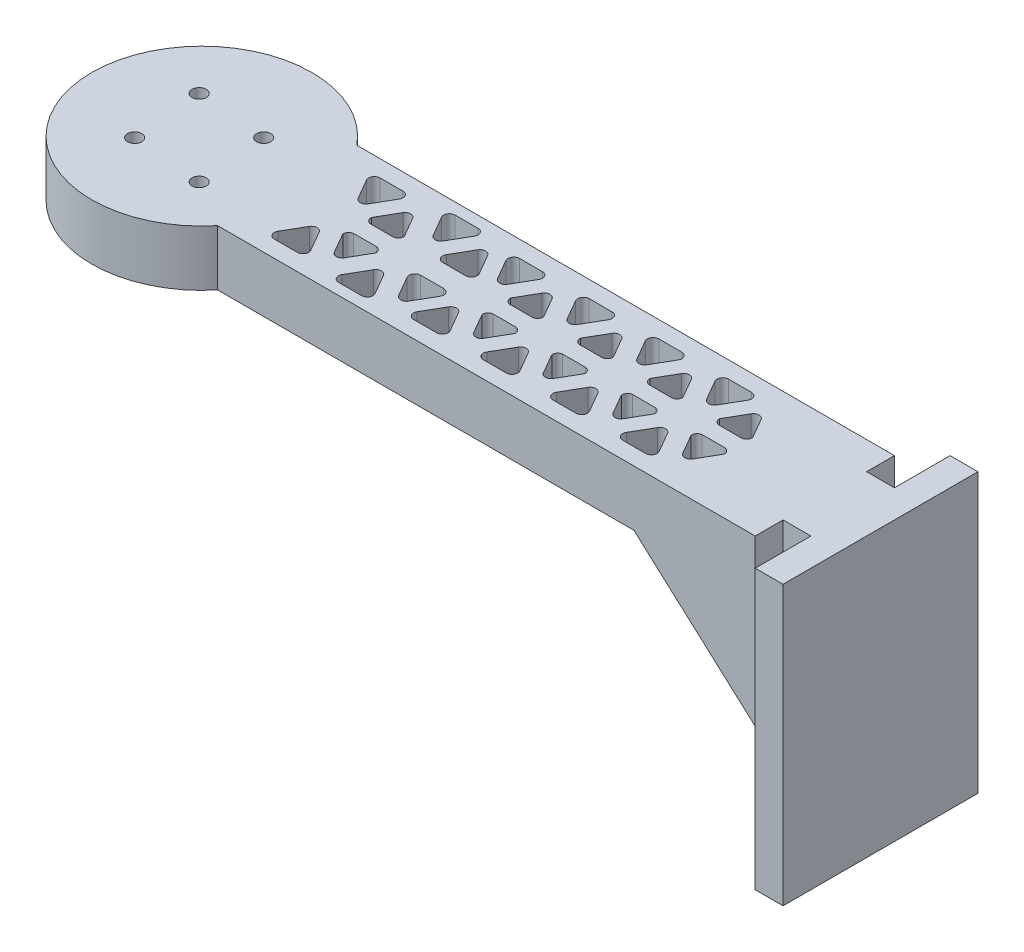
from build123d import *

# Parameters (mm, degrees)
SKETCH1_R           = 1.279919877
BOSS_EXTRUDE2_DEPTH = 10
BOSS_EXTRUDE3_DEPTH = 50
BOSS_EXTRUDE4_REACH = 134.247
CUT_EXTRUDE1_REACH  = 135.257
SKETCH2_3_W         = 5
SKETCH2_3_H         = 5


with BuildPart() as part:
    # Sketch1 → Boss-Extrude2 (new body)
    with BuildSketch(Plane(origin=(0, 0, 0), x_dir=(1, 0, 0), z_dir=(0, 1, 0))):
        with BuildLine():
            Line((121.848372292, 12.975710063), (15.332022575, 12.975710063))
            ThreePointArc((15.332022575, 12.975710063), (-19.781832985, 0.475710063), (15.332022575, -12.024289937))
            Line((15.332022575, -12.024289937), (121.848372292, -12.024289937))
            Line((121.848372292, -12.024289937), (121.848372292, 12.975710063))
        make_face()
        with BuildLine():
            Line((27.867718097, 3.040074135), (29.934981691, 6.618383951))
            ThreePointArc((29.934981691, 6.618383951), (30.821593952, 7.13010561), (31.708206213, 6.618383951))
            Line((31.708206213, 6.618383951), (33.775469807, 3.032226152))
            ThreePointArc((33.775469807, 3.032226152), (33.536731527, 2.332297873), (32.888857546, 1.975710063))
            Line((32.888857546, 1.975710063), (28.754330358, 1.975710063))
            ThreePointArc((28.754330358, 1.975710063), (28.103716588, 2.335205422), (27.867718097, 3.040074135))
        make_face(mode=Mode.SUBTRACT)
        with BuildLine():
            ThreePointArc((46.281498727, 3.999342244), (46.287424275, 2.96938023), (45.394886466, 2.455344118))
            Line((45.394886466, 2.455344118), (41.260359278, 2.455344118))
            ThreePointArc((41.260359278, 2.455344118), (40.373533681, 2.967435229), (40.373747018, 3.991494261))
            Line((40.373747018, 3.991494261), (42.441010611, 7.57765206))
            ThreePointArc((42.441010611, 7.57765206), (43.327622872, 8.08937372), (44.214235133, 7.57765206))
            Line((44.214235133, 7.57765206), (46.281498727, 3.999342244))
        make_face(mode=Mode.SUBTRACT)
        with BuildLine():
            ThreePointArc((21.614703637, 8.43955992), (21.6144903, 9.463618952), (22.501315898, 9.975710063))
            Line((22.501315898, 9.975710063), (26.635843086, 9.975710063))
            ThreePointArc((26.635843086, 9.975710063), (27.522668684, 9.463618952), (27.522455347, 8.43955992))
            Line((27.522455347, 8.43955992), (25.455191753, 4.861250104))
            ThreePointArc((25.455191753, 4.861250104), (24.568579492, 4.349528444), (23.681967231, 4.861250104))
            Line((23.681967231, 4.861250104), (21.614703637, 8.43955992))
        make_face(mode=Mode.SUBTRACT)
        with BuildLine():
            ThreePointArc((39.141872006, 10.934978173), (40.028697604, 10.422887062), (40.028484267, 9.398828029))
            Line((40.028484267, 9.398828029), (37.961220673, 5.820518214))
            ThreePointArc((37.961220673, 5.820518214), (37.074608412, 5.308796554), (36.187996151, 5.820518214))
            Line((36.187996151, 5.820518214), (34.120732557, 9.398828029))
            ThreePointArc((34.120732557, 9.398828029), (34.12051922, 10.422887062), (35.007344818, 10.934978173))
            Line((35.007344818, 10.934978173), (39.141872006, 10.934978173))
        make_face(mode=Mode.SUBTRACT)
        with BuildLine():
            ThreePointArc((46.634703637, 8.43955992), (46.6344903, 9.463618952), (47.521315898, 9.975710063))
            Line((47.521315898, 9.975710063), (51.655843086, 9.975710063))
            ThreePointArc((51.655843086, 9.975710063), (52.542668684, 9.463618952), (52.542455347, 8.43955992))
            Line((52.542455347, 8.43955992), (50.475191753, 4.861250104))
            ThreePointArc((50.475191753, 4.861250104), (49.588579492, 4.349528444), (48.701967231, 4.861250104))
            Line((48.701967231, 4.861250104), (46.634703637, 8.43955992))
        make_face(mode=Mode.SUBTRACT)
        with BuildLine():
            Line((52.887718097, 3.040074135), (54.954981691, 6.618383951))
            ThreePointArc((54.954981691, 6.618383951), (55.841593952, 7.13010561), (56.728206213, 6.618383951))
            Line((56.728206213, 6.618383951), (58.795469807, 3.032226152))
            ThreePointArc((58.795469807, 3.032226152), (58.556731527, 2.332297873), (57.908857546, 1.975710063))
            Line((57.908857546, 1.975710063), (53.774330358, 1.975710063))
            ThreePointArc((53.774330358, 1.975710063), (53.123716588, 2.335205422), (52.887718097, 3.040074135))
        make_face(mode=Mode.SUBTRACT)
        with BuildLine():
            Line((65.397718097, 3.040074135), (67.464981691, 6.618383951))
            ThreePointArc((67.464981691, 6.618383951), (68.351593952, 7.13010561), (69.238206213, 6.618383951))
            Line((69.238206213, 6.618383951), (71.305469807, 3.032226152))
            ThreePointArc((71.305469807, 3.032226152), (71.066731527, 2.332297873), (70.418857546, 1.975710063))
            Line((70.418857546, 1.975710063), (66.284330358, 1.975710063))
            ThreePointArc((66.284330358, 1.975710063), (65.633716588, 2.335205422), (65.397718097, 3.040074135))
        make_face(mode=Mode.SUBTRACT)
        with BuildLine():
            Line((77.907718097, 3.040074135), (79.974981691, 6.618383951))
            ThreePointArc((79.974981691, 6.618383951), (80.861593952, 7.13010561), (81.748206213, 6.618383951))
            Line((81.748206213, 6.618383951), (83.815469807, 3.032226152))
            ThreePointArc((83.815469807, 3.032226152), (83.576731527, 2.332297873), (82.928857546, 1.975710063))
            Line((82.928857546, 1.975710063), (78.794330358, 1.975710063))
            ThreePointArc((78.794330358, 1.975710063), (78.143716588, 2.335205422), (77.907718097, 3.040074135))
        make_face(mode=Mode.SUBTRACT)
        with BuildLine():
            ThreePointArc((59.144703637, 8.43955992), (59.1444903, 9.463618952), (60.031315898, 9.975710063))
            Line((60.031315898, 9.975710063), (64.165843086, 9.975710063))
            ThreePointArc((64.165843086, 9.975710063), (65.052668684, 9.463618952), (65.052455347, 8.43955992))
            Line((65.052455347, 8.43955992), (62.985191753, 4.861250104))
            ThreePointArc((62.985191753, 4.861250104), (62.098579492, 4.349528444), (61.211967231, 4.861250104))
            Line((61.211967231, 4.861250104), (59.144703637, 8.43955992))
        make_face(mode=Mode.SUBTRACT)
        with BuildLine():
            ThreePointArc((71.654703637, 8.43955992), (71.6544903, 9.463618952), (72.541315898, 9.975710063))
            Line((72.541315898, 9.975710063), (76.675843086, 9.975710063))
            ThreePointArc((76.675843086, 9.975710063), (77.562668684, 9.463618952), (77.562455347, 8.43955992))
            Line((77.562455347, 8.43955992), (75.495191753, 4.861250104))
            ThreePointArc((75.495191753, 4.861250104), (74.608579492, 4.349528444), (73.721967231, 4.861250104))
            Line((73.721967231, 4.861250104), (71.654703637, 8.43955992))
        make_face(mode=Mode.SUBTRACT)
        with BuildLine():
            Line((90.417718097, 3.040074135), (92.484981691, 6.618383951))
            ThreePointArc((92.484981691, 6.618383951), (93.371593952, 7.13010561), (94.258206213, 6.618383951))
            Line((94.258206213, 6.618383951), (96.325469807, 3.032226152))
            ThreePointArc((96.325469807, 3.032226152), (96.086731527, 2.332297873), (95.438857546, 1.975710063))
            Line((95.438857546, 1.975710063), (91.304330358, 1.975710063))
            ThreePointArc((91.304330358, 1.975710063), (90.653716588, 2.335205422), (90.417718097, 3.040074135))
        make_face(mode=Mode.SUBTRACT)
        with BuildLine():
            ThreePointArc((84.164703637, 8.43955992), (84.1644903, 9.463618952), (85.051315898, 9.975710063))
            Line((85.051315898, 9.975710063), (89.185843086, 9.975710063))
            ThreePointArc((89.185843086, 9.975710063), (90.072668684, 9.463618952), (90.072455347, 8.43955992))
            Line((90.072455347, 8.43955992), (88.005191753, 4.861250104))
            ThreePointArc((88.005191753, 4.861250104), (87.118579492, 4.349528444), (86.231967231, 4.861250104))
            Line((86.231967231, 4.861250104), (84.164703637, 8.43955992))
        make_face(mode=Mode.SUBTRACT)
        with Locations(Location((5.792256156, 5.792256156, 0), (0, 0, 270))):
            Circle(SKETCH1_R, mode=Mode.SUBTRACT)
        with Locations(Location((-5.792256156, -5.792256156, 0), (0, 0, 270))):
            Circle(SKETCH1_R, mode=Mode.SUBTRACT)
        with Locations(Location((6.878304186, -6.878304186, 0), (0, 0, 270))):
            Circle(SKETCH1_R, mode=Mode.SUBTRACT)
        with Locations(Location((-6.878304186, 6.878304186, 0), (0, 0, 270))):
            Circle(SKETCH1_R, mode=Mode.SUBTRACT)
        with BuildLine():
            ThreePointArc((95.438857546, -1.024289937), (96.086731527, -1.380877747), (96.325469807, -2.080806025))
            Line((96.325469807, -2.080806025), (94.258206213, -5.666963824))
            ThreePointArc((94.258206213, -5.666963824), (93.371593952, -6.178685484), (92.484981691, -5.666963824))
            Line((92.484981691, -5.666963824), (90.417718097, -2.088654008))
            ThreePointArc((90.417718097, -2.088654008), (90.653716588, -1.383785295), (91.304330358, -1.024289937))
            Line((91.304330358, -1.024289937), (95.438857546, -1.024289937))
        make_face(mode=Mode.SUBTRACT)
        with BuildLine():
            Line((21.614703637, -7.488139793), (23.681967231, -3.909829978))
            ThreePointArc((23.681967231, -3.909829978), (24.568579492, -3.398108318), (25.455191753, -3.909829978))
            Line((25.455191753, -3.909829978), (27.522455347, -7.488139793))
            ThreePointArc((27.522455347, -7.488139793), (27.522668684, -8.512198826), (26.635843086, -9.024289937))
            Line((26.635843086, -9.024289937), (22.501315898, -9.024289937))
            ThreePointArc((22.501315898, -9.024289937), (21.6144903, -8.512198826), (21.614703637, -7.488139793))
        make_face(mode=Mode.SUBTRACT)
        with BuildLine():
            ThreePointArc((40.028484267, -8.447407903), (40.028697604, -9.471466935), (39.141872006, -9.983558046))
            Line((39.141872006, -9.983558046), (35.007344818, -9.983558046))
            ThreePointArc((35.007344818, -9.983558046), (34.12051922, -9.471466935), (34.120732557, -8.447407903))
            Line((34.120732557, -8.447407903), (36.187996151, -4.869098087))
            ThreePointArc((36.187996151, -4.869098087), (37.074608412, -4.357376427), (37.961220673, -4.869098087))
            Line((37.961220673, -4.869098087), (40.028484267, -8.447407903))
        make_face(mode=Mode.SUBTRACT)
        with BuildLine():
            Line((46.634703637, -7.488139793), (48.701967231, -3.909829978))
            ThreePointArc((48.701967231, -3.909829978), (49.588579492, -3.398108318), (50.475191753, -3.909829978))
            Line((50.475191753, -3.909829978), (52.542455347, -7.488139793))
            ThreePointArc((52.542455347, -7.488139793), (52.542668684, -8.512198826), (51.655843086, -9.024289937))
            Line((51.655843086, -9.024289937), (47.521315898, -9.024289937))
            ThreePointArc((47.521315898, -9.024289937), (46.6344903, -8.512198826), (46.634703637, -7.488139793))
        make_face(mode=Mode.SUBTRACT)
        with BuildLine():
            ThreePointArc((27.867718097, -2.088654008), (28.103716588, -1.383785295), (28.754330358, -1.024289937))
            Line((28.754330358, -1.024289937), (32.888857546, -1.024289937))
            ThreePointArc((32.888857546, -1.024289937), (33.536731527, -1.380877747), (33.775469807, -2.080806025))
            Line((33.775469807, -2.080806025), (31.708206213, -5.666963824))
            ThreePointArc((31.708206213, -5.666963824), (30.821593952, -6.178685484), (29.934981691, -5.666963824))
            Line((29.934981691, -5.666963824), (27.867718097, -2.088654008))
        make_face(mode=Mode.SUBTRACT)
        with BuildLine():
            Line((46.281498727, -3.047922118), (44.214235133, -6.626231934))
            ThreePointArc((44.214235133, -6.626231934), (43.327622872, -7.137953593), (42.441010611, -6.626231934))
            Line((42.441010611, -6.626231934), (40.373747018, -3.040074135))
            ThreePointArc((40.373747018, -3.040074135), (40.373533681, -2.016015103), (41.260359278, -1.503923991))
            Line((41.260359278, -1.503923991), (45.394886466, -1.503923991))
            ThreePointArc((45.394886466, -1.503923991), (46.287424275, -2.017960103), (46.281498727, -3.047922118))
        make_face(mode=Mode.SUBTRACT)
        with BuildLine():
            Line((59.144703637, -7.488139793), (61.211967231, -3.909829978))
            ThreePointArc((61.211967231, -3.909829978), (62.098579492, -3.398108318), (62.985191753, -3.909829978))
            Line((62.985191753, -3.909829978), (65.052455347, -7.488139793))
            ThreePointArc((65.052455347, -7.488139793), (65.052668684, -8.512198826), (64.165843086, -9.024289937))
            Line((64.165843086, -9.024289937), (60.031315898, -9.024289937))
            ThreePointArc((60.031315898, -9.024289937), (59.1444903, -8.512198826), (59.144703637, -7.488139793))
        make_face(mode=Mode.SUBTRACT)
        with BuildLine():
            Line((71.654703637, -7.488139793), (73.721967231, -3.909829978))
            ThreePointArc((73.721967231, -3.909829978), (74.608579492, -3.398108318), (75.495191753, -3.909829978))
            Line((75.495191753, -3.909829978), (77.562455347, -7.488139793))
            ThreePointArc((77.562455347, -7.488139793), (77.562668684, -8.512198826), (76.675843086, -9.024289937))
            Line((76.675843086, -9.024289937), (72.541315898, -9.024289937))
            ThreePointArc((72.541315898, -9.024289937), (71.6544903, -8.512198826), (71.654703637, -7.488139793))
        make_face(mode=Mode.SUBTRACT)
        with BuildLine():
            ThreePointArc((52.887718097, -2.088654008), (53.123716588, -1.383785295), (53.774330358, -1.024289937))
            Line((53.774330358, -1.024289937), (57.908857546, -1.024289937))
            ThreePointArc((57.908857546, -1.024289937), (58.556731527, -1.380877747), (58.795469807, -2.080806025))
            Line((58.795469807, -2.080806025), (56.728206213, -5.666963824))
            ThreePointArc((56.728206213, -5.666963824), (55.841593952, -6.178685484), (54.954981691, -5.666963824))
            Line((54.954981691, -5.666963824), (52.887718097, -2.088654008))
        make_face(mode=Mode.SUBTRACT)
        with BuildLine():
            ThreePointArc((65.397718097, -2.088654008), (65.633716588, -1.383785295), (66.284330358, -1.024289937))
            Line((66.284330358, -1.024289937), (70.418857546, -1.024289937))
            ThreePointArc((70.418857546, -1.024289937), (71.066731527, -1.380877747), (71.305469807, -2.080806025))
            Line((71.305469807, -2.080806025), (69.238206213, -5.666963824))
            ThreePointArc((69.238206213, -5.666963824), (68.351593952, -6.178685484), (67.464981691, -5.666963824))
            Line((67.464981691, -5.666963824), (65.397718097, -2.088654008))
        make_face(mode=Mode.SUBTRACT)
        with BuildLine():
            ThreePointArc((77.907718097, -2.088654008), (78.143716588, -1.383785295), (78.794330358, -1.024289937))
            Line((78.794330358, -1.024289937), (82.928857546, -1.024289937))
            ThreePointArc((82.928857546, -1.024289937), (83.576731527, -1.380877747), (83.815469807, -2.080806025))
            Line((83.815469807, -2.080806025), (81.748206213, -5.666963824))
            ThreePointArc((81.748206213, -5.666963824), (80.861593952, -6.178685484), (79.974981691, -5.666963824))
            Line((79.974981691, -5.666963824), (77.907718097, -2.088654008))
        make_face(mode=Mode.SUBTRACT)
        with BuildLine():
            Line((84.164703637, -7.488139793), (86.231967231, -3.909829978))
            ThreePointArc((86.231967231, -3.909829978), (87.118579492, -3.398108318), (88.005191753, -3.909829978))
            Line((88.005191753, -3.909829978), (90.072455347, -7.488139793))
            ThreePointArc((90.072455347, -7.488139793), (90.072668684, -8.512198826), (89.185843086, -9.024289937))
            Line((89.185843086, -9.024289937), (85.051315898, -9.024289937))
            ThreePointArc((85.051315898, -9.024289937), (84.1644903, -8.512198826), (84.164703637, -7.488139793))
        make_face(mode=Mode.SUBTRACT)
    extrude(amount=BOSS_EXTRUDE2_DEPTH)

    # Sketch2 → Boss-Extrude3 (add)
    with BuildSketch(Plane(origin=(0, 10, 0), x_dir=(1, 0, 0), z_dir=(0, 1, 0))):
        Polygon((121.848372292, 12.975710063), (121.848372292, 17.975710063), (116.848372292, 17.975710063), (116.848372292, 12.975710063), (116.848372292, -12.024289937), (116.848372292, -17.024289937), (121.848372292, -17.024289937), (121.848372292, -12.024289937), align=None)
    extrude(amount=-BOSS_EXTRUDE3_DEPTH)

    # Boss-Extrude4: up to this face of the body (flat: up to its plane)
    boss_extrude4_end = Plane(part.part.faces().sort_by_distance((66.090197433, 5, -12.975710063))[0])
    # Sketch3 → Boss-Extrude4 (add, up to the picked face)
    with BuildSketch(Plane.XY.offset(12.024289937), mode=Mode.PRIVATE) as boss_extrude4_sk1:
        Polygon((90.072455347, 0), (116.848372292, -24.081106476), (116.848372292, 0), align=None)
    boss_extrude4_tool1 = split(extrude(boss_extrude4_sk1.sketch, amount=-BOSS_EXTRUDE4_REACH, mode=Mode.PRIVATE), bisect_by=boss_extrude4_end, keep=Keep.BOTH, mode=Mode.PRIVATE)
    add(boss_extrude4_tool1.solids().sort_by(Axis((107.923067, -8.027035, 12.02429), (0, 0, -1)))[0])

    # Cut-Extrude1: up to this plane
    cut_extrude1_end = Plane(origin=(90.072455347, 0, -48.987505594), z_dir=(-0.6687005221736984, -0.7435318497849459, 0))
    # Sketch2<3> → Cut-Extrude1 (cut, up to the surface)
    with BuildSketch(Plane(origin=(0, 10, 0), x_dir=(1, 0, 0), z_dir=(0, 1, 0)), mode=Mode.PRIVATE) as cut_extrude1_sk1:
        with Locations((114.348372292, 10.475710063)):
            Rectangle(SKETCH2_3_W, SKETCH2_3_H)
    cut_extrude1_tool1 = split(extrude(cut_extrude1_sk1.sketch, amount=-CUT_EXTRUDE1_REACH, mode=Mode.PRIVATE), bisect_by=cut_extrude1_end, keep=Keep.BOTH, mode=Mode.PRIVATE)
    add(cut_extrude1_tool1.solids().sort_by_distance((114.348372, 10, -10.47571))[0], mode=Mode.SUBTRACT)
    # Sketch2<3> → Cut-Extrude1 (cut, up to the surface)
    with BuildSketch(Plane(origin=(0, 10, 0), x_dir=(1, 0, 0), z_dir=(0, 1, 0)), mode=Mode.PRIVATE) as cut_extrude1_sk2:
        with Locations((114.348372292, -9.524289937)):
            Rectangle(SKETCH2_3_W, SKETCH2_3_H)
    cut_extrude1_tool2 = split(extrude(cut_extrude1_sk2.sketch, amount=-CUT_EXTRUDE1_REACH, mode=Mode.PRIVATE), bisect_by=cut_extrude1_end, keep=Keep.BOTH, mode=Mode.PRIVATE)
    add(cut_extrude1_tool2.solids().sort_by_distance((114.348372, 10, 9.52429))[0], mode=Mode.SUBTRACT)


solid = part.part
